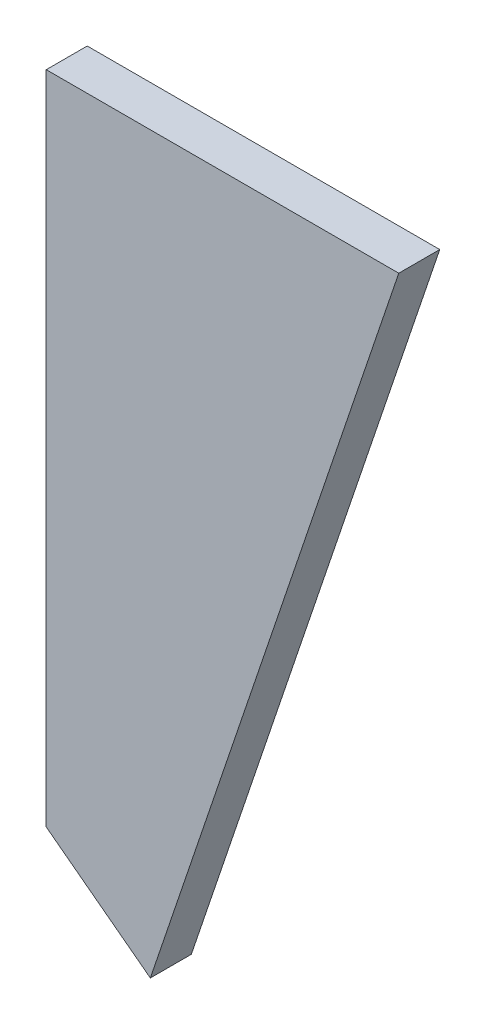
from build123d import *

# Parameters (mm, degrees)
RESSALTO_EXTRUS_O1_DEPTH = 3


with BuildPart() as part:
    # Esboço1 → Ressalto-extrusão1 (new body)
    with BuildSketch(Plane.XY):
        Polygon((7.618089984, -5.762640579), (25.8, 48), (0, 48), (0, 0), align=None)
    extrude(amount=RESSALTO_EXTRUS_O1_DEPTH)


solid = part.part
